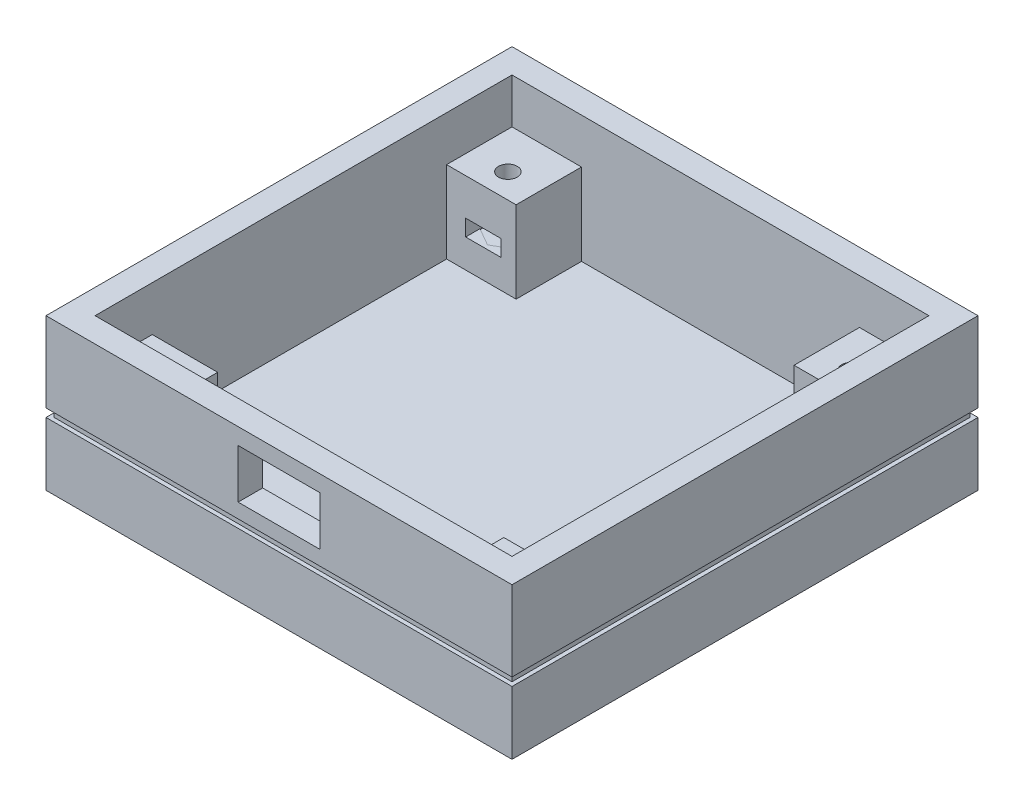
from build123d import *

# Parameters (mm, degrees)
ESQUISSE1_W              = 57
ESQUISSE1_H              = 57
BOSS_EXTRU_1_DEPTH       = 18.5
ESQUISSE2_W              = 51
ESQUISSE2_H              = 51
ENL_V_MAT_EXTRU_1_DEPTH  = 15.5
ESQUISSE4_W              = 8.5
ESQUISSE4_H              = 8
BOSS_EXTRU_2_DEPTH       = 10
ESQUISSE5_W              = 8.5
ESQUISSE5_H              = 8
BOSS_EXTRU_3_DEPTH       = 10
ESQUISSE6_W              = 8
ESQUISSE6_H              = 7
BOSS_EXTRU_4_DEPTH       = 10
ESQUISSE7_W              = 8
ESQUISSE7_H              = 7
BOSS_EXTRU_5_DEPTH       = 10
ESQUISSE8_R              = 1.15
ENL_V_MAT_EXTRU_2_DEPTH  = 10
ESQUISSE9_R              = 1.15
ENL_V_MAT_EXTRU_3_DEPTH  = 10
ESQUISSE16_R             = 1.15
ENL_V_MAT_EXTRU_9_DEPTH  = 6.6
ESQUISSE17_R             = 1.15
ENL_V_MAT_EXTRU_10_DEPTH = 10
ESQUISSE21_W             = 10
ESQUISSE21_H             = 6
ENL_V_MAT_EXTRU_14_DEPTH = 3
ENL_V_START              = -8
ENL_V_MAT_EXTRU_18_DEPTH = 2
ENL_V_MAT_EXTRU_20_DEPTH = 2
ESQUISSE26_W             = 4.34
ESQUISSE26_H             = 2
ENL_V_MAT_EXTRU_21_DEPTH = 2.847955181
ENL_V_START_2            = -4.5
ENL_V_MAT_EXTRU_22_DEPTH = 2.1
ENL_V_MAT_EXTRU_24_DEPTH = 2
ESQUISSE23_W             = 4.34
ESQUISSE23_H             = 2
ENL_V_MAT_EXTRU_26_DEPTH = 2
ESQUISSE31_W             = 4.34
ESQUISSE31_H             = 2
ENL_V_MAT_EXTRU_27_DEPTH = 2
ESQUISSE30_W             = 4.34
ESQUISSE30_H             = 2
ENL_V_MAT_EXTRU_28_DEPTH = 2
ESQUISSE32_W             = 57
ESQUISSE32_H             = 1
ENL_V_MAT_EXTRU_29_DEPTH = 0.5
ESQUISSE33_W             = 57
ESQUISSE33_H             = 1
ENL_V_MAT_EXTRU_30_DEPTH = 0.5
ESQUISSE34_W             = 57
ESQUISSE34_H             = 1
ENL_V_MAT_EXTRU_31_DEPTH = 0.5
ESQUISSE35_W             = 57
ESQUISSE35_H             = 1
ENL_V_MAT_EXTRU_32_DEPTH = 0.5


with BuildPart() as part:
    # Esquisse1 → Boss.-Extru.1 (new body)
    with BuildSketch(Plane(origin=(0, 0, 0), x_dir=(1, 0, 0), z_dir=(0, 1, 0))):
        with Locations((-1.510072399, 8.394175698)):
            Rectangle(ESQUISSE1_W, ESQUISSE1_H)
    extrude(amount=BOSS_EXTRU_1_DEPTH)

    # Esquisse2 → Enlèv. mat.-Extru.1 (cut)
    with BuildSketch(Plane(origin=(0, 18.5, 0), x_dir=(1, 0, 0), z_dir=(0, 1, 0))):
        with Locations((-1.510072399, 8.394175698)):
            Rectangle(ESQUISSE2_W, ESQUISSE2_H)
    extrude(amount=-ENL_V_MAT_EXTRU_1_DEPTH, mode=Mode.SUBTRACT)

    # Esquisse4 → Boss.-Extru.2 (add)
    with BuildSketch(Plane(origin=(0, 3, 0), x_dir=(1, 0, 0), z_dir=(0, 1, 0))):
        with Locations((-22.760072399, 29.894175698)):
            Rectangle(ESQUISSE4_W, ESQUISSE4_H)
    extrude(amount=BOSS_EXTRU_2_DEPTH)

    # Esquisse5 → Boss.-Extru.3 (add)
    with BuildSketch(Plane(origin=(0, 3, 0), x_dir=(1, 0, 0), z_dir=(0, 1, 0))):
        with Locations((19.739927601, 29.894175698)):
            Rectangle(ESQUISSE5_W, ESQUISSE5_H)
    extrude(amount=BOSS_EXTRU_3_DEPTH)

    # Esquisse6 → Boss.-Extru.4 (add)
    with BuildSketch(Plane(origin=(0, 3, 0), x_dir=(1, 0, 0), z_dir=(0, 1, 0))):
        with Locations((19.989927601, -13.605824302)):
            Rectangle(ESQUISSE6_W, ESQUISSE6_H)
    extrude(amount=BOSS_EXTRU_4_DEPTH)

    # Esquisse7 → Boss.-Extru.5 (add)
    with BuildSketch(Plane(origin=(0, 3, 0), x_dir=(1, 0, 0), z_dir=(0, 1, 0))):
        with Locations((-23.010072399, -13.605824302)):
            Rectangle(ESQUISSE7_W, ESQUISSE7_H)
    extrude(amount=BOSS_EXTRU_5_DEPTH)

    # Esquisse8 → Enlèv. mat.-Extru.2 (cut)
    with BuildSketch(Plane(origin=(0, 13, 0), x_dir=(1, 0, 0), z_dir=(0, 1, 0))):
        with Locations(Location((19.489927601, -13.105824302, 0), (0, 0, 270))):
            Circle(ESQUISSE8_R)
    extrude(amount=-ENL_V_MAT_EXTRU_2_DEPTH, mode=Mode.SUBTRACT)

    # Esquisse9 → Enlèv. mat.-Extru.3 (cut)
    with BuildSketch(Plane(origin=(0, 13, 0), x_dir=(1, 0, 0), z_dir=(0, 1, 0))):
        with Locations(Location((-22.510072399, -13.105824302, 0), (0, 0, 270))):
            Circle(ESQUISSE9_R)
    extrude(amount=-ENL_V_MAT_EXTRU_3_DEPTH, mode=Mode.SUBTRACT)

    # Esquisse16 → Enlèv. mat.-Extru.9 (cut)
    with BuildSketch(Plane(origin=(0, 13, 0), x_dir=(1, 0, 0), z_dir=(0, 1, 0))):
        with Locations(Location((-22.510072399, 28.894175698, 0), (0, 0, 270))):
            Circle(ESQUISSE16_R)
    extrude(amount=-ENL_V_MAT_EXTRU_9_DEPTH, mode=Mode.SUBTRACT)

    # Esquisse17 → Enlèv. mat.-Extru.10 (cut)
    with BuildSketch(Plane(origin=(0, 13, 0), x_dir=(1, 0, 0), z_dir=(0, 1, 0))):
        with Locations(Location((19.489927601, 28.894175698, 0), (0, 0, 270))):
            Circle(ESQUISSE17_R)
    extrude(amount=-ENL_V_MAT_EXTRU_10_DEPTH, mode=Mode.SUBTRACT)

    # Esquisse21 → Enlèv. mat.-Extru.14 (cut)
    with BuildSketch(Plane.XY.offset(20.105824302)):
        with Locations((-1.510072399, 13.5)):
            Rectangle(ESQUISSE21_W, ESQUISSE21_H)
    extrude(amount=-ENL_V_MAT_EXTRU_14_DEPTH, mode=Mode.SUBTRACT)

    # Esquisse24 → Enlèv. mat.-Extru.18 (cut)
    with BuildSketch(Plane(origin=(0, 13, 0), x_dir=(1, 0, 0), z_dir=(0, 1, 0)).offset(ENL_V_START)):
        Polygon((19.489927601, 26.394175698), (21.65499111, 27.644175698), (21.65499111, 30.144175698), (19.489927601, 31.394175698), (17.324864091, 30.144175698), (17.324864091, 27.644175698), align=None)
    extrude(amount=-ENL_V_MAT_EXTRU_18_DEPTH, mode=Mode.SUBTRACT)

    # Esquisse25 → Enlèv. mat.-Extru.20 (cut)
    with BuildSketch(Plane(origin=(0, 13, 0), x_dir=(1, 0, 0), z_dir=(0, 1, 0)).offset(ENL_V_START)):
        Polygon((17.324864091, -11.855824302), (17.324864091, -14.355824302), (19.489927601, -15.605824302), (21.65499111, -14.355824302), (21.65499111, -11.855824302), (19.489927601, -10.605824302), align=None)
    extrude(amount=-ENL_V_MAT_EXTRU_20_DEPTH, mode=Mode.SUBTRACT)

    # Esquisse26 → Enlèv. mat.-Extru.21 (cut)
    with BuildSketch(Plane(origin=(0, 0, 10.105824302), x_dir=(-1, 0, 0), z_dir=(0, 0, -1))):
        with Locations((-19.489927601, 4)):
            Rectangle(ESQUISSE26_W, ESQUISSE26_H)
    extrude(amount=-ENL_V_MAT_EXTRU_21_DEPTH, mode=Mode.SUBTRACT)

    # Esquisse27 → Enlèv. mat.-Extru.22 (cut)
    with BuildSketch(Plane(origin=(0, 13, 0), x_dir=(1, 0, 0), z_dir=(0, 1, 0)).offset(ENL_V_START_2)):
        Polygon((-20.34500889, 27.644175698), (-20.34500889, 30.144175698), (-22.510072399, 31.394175698), (-24.675135909, 30.144175698), (-24.675135909, 27.644175698), (-22.510072399, 26.394175698), align=None)
    extrude(amount=-ENL_V_MAT_EXTRU_22_DEPTH, mode=Mode.SUBTRACT)

    # Esquisse29 → Enlèv. mat.-Extru.24 (cut)
    with BuildSketch(Plane(origin=(0, 13, 0), x_dir=(1, 0, 0), z_dir=(0, 1, 0)).offset(ENL_V_START)):
        Polygon((-20.34500889, -11.855824302), (-22.510072399, -10.605824302), (-24.675135909, -11.855824302), (-24.675135909, -14.355824302), (-22.510072399, -15.605824302), (-20.34500889, -14.355824302), align=None)
    extrude(amount=-ENL_V_MAT_EXTRU_24_DEPTH, mode=Mode.SUBTRACT)

    # Esquisse23 → Enlèv. mat.-Extru.26 (cut)
    with BuildSketch(Plane.XY.offset(-25.894175698)):
        with Locations((19.489927601, 4)):
            Rectangle(ESQUISSE23_W, ESQUISSE23_H)
    extrude(amount=-ENL_V_MAT_EXTRU_26_DEPTH, mode=Mode.SUBTRACT)

    # Esquisse31 → Enlèv. mat.-Extru.27 (cut)
    with BuildSketch(Plane.XY.offset(-25.894175698)):
        with Locations((-22.510072399, 7.5)):
            Rectangle(ESQUISSE31_W, ESQUISSE31_H)
    extrude(amount=-ENL_V_MAT_EXTRU_27_DEPTH, mode=Mode.SUBTRACT)

    # Esquisse30 → Enlèv. mat.-Extru.28 (cut)
    with BuildSketch(Plane(origin=(0, 0, 10.105824302), x_dir=(-1, 0, 0), z_dir=(0, 0, -1))):
        with Locations((22.510072399, 4)):
            Rectangle(ESQUISSE30_W, ESQUISSE30_H)
    extrude(amount=-ENL_V_MAT_EXTRU_28_DEPTH, mode=Mode.SUBTRACT)

    # Esquisse32 → Enlèv. mat.-Extru.29 (cut)
    with BuildSketch(Plane.ZY.offset(30.010072399)):
        with Locations((-8.394175698, 8.219994516)):
            Rectangle(ESQUISSE32_W, ESQUISSE32_H)
    extrude(amount=-ENL_V_MAT_EXTRU_29_DEPTH, mode=Mode.SUBTRACT)

    # Esquisse33 → Enlèv. mat.-Extru.30 (cut)
    with BuildSketch(Plane.XY.offset(20.105824302)):
        with Locations((-1.510072399, 8.219994516)):
            Rectangle(ESQUISSE33_W, ESQUISSE33_H)
    extrude(amount=-ENL_V_MAT_EXTRU_30_DEPTH, mode=Mode.SUBTRACT)

    # Esquisse34 → Enlèv. mat.-Extru.31 (cut)
    with BuildSketch(Plane(origin=(26.989927601, 0, 0), x_dir=(0, 0, -1), z_dir=(1, 0, 0))):
        with Locations((8.394175698, 8.219994516)):
            Rectangle(ESQUISSE34_W, ESQUISSE34_H)
    extrude(amount=-ENL_V_MAT_EXTRU_31_DEPTH, mode=Mode.SUBTRACT)

    # Esquisse35 → Enlèv. mat.-Extru.32 (cut)
    with BuildSketch(Plane(origin=(0, 0, -36.894175698), x_dir=(-1, 0, 0), z_dir=(0, 0, -1))):
        with Locations((1.510072399, 8.219994516)):
            Rectangle(ESQUISSE35_W, ESQUISSE35_H)
    extrude(amount=-ENL_V_MAT_EXTRU_32_DEPTH, mode=Mode.SUBTRACT)


solid = part.part
